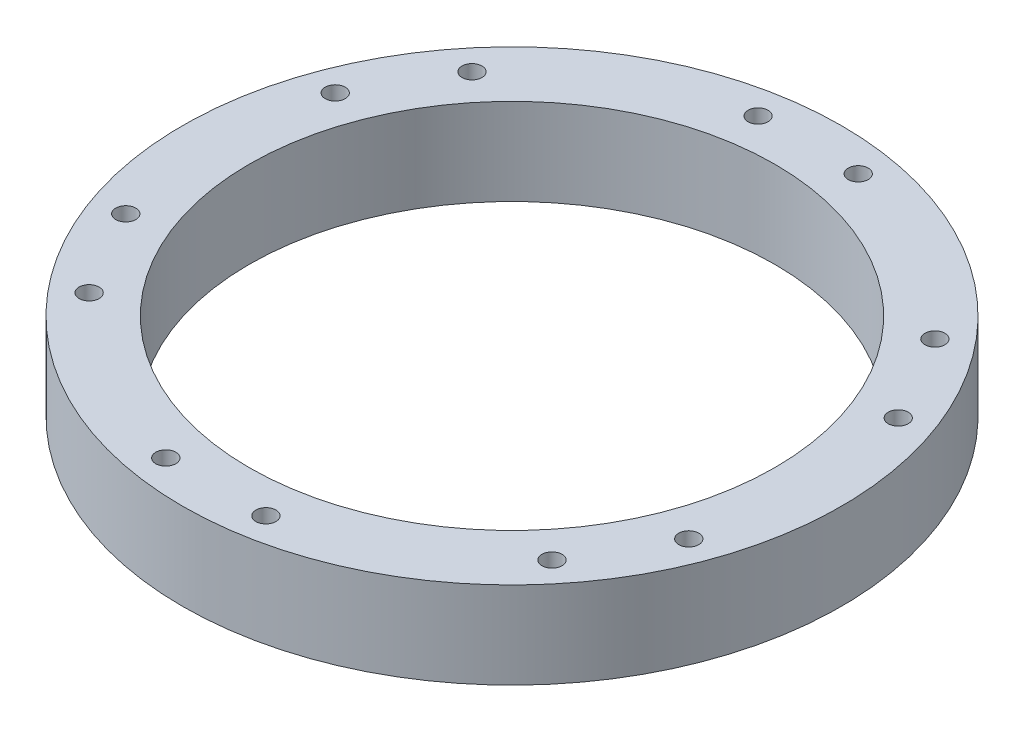
from build123d import *

# Parameters (mm, degrees)
SKETCH1_R           = 49.375
SKETCH1_R_2         = 39.375
BOSS_EXTRUDE1_DEPTH = 13
CUT_EXTRUDE1_REACH  = 73.027
SKETCH2_R           = 1.5
CIRPATTERN1_COUNT   = 6


with BuildPart() as part:
    # Sketch1 → Boss-Extrude1 (new body)
    with BuildSketch(Plane(origin=(0, 0, 0), x_dir=(1, 0, 0), z_dir=(0, 1, 0))):
        with Locations(Location((0, 0, 0), (0, 0, 90))):
            Circle(SKETCH1_R)
        with Locations(Location((0, 0, 0), (0, 0, 90))):
            Circle(SKETCH1_R_2, mode=Mode.SUBTRACT)
    extrude(amount=BOSS_EXTRUDE1_DEPTH)

    # Sketch2 → Cut-Extrude1 (cut, up to next)
    with BuildSketch(Plane(origin=(0, 13, 0), x_dir=(1, 0, 0), z_dir=(0, 1, 0)), mode=Mode.PRIVATE) as cut_extrude1_sk1:
        with Locations(Location((-7.5, -44.370598373, 0), (0, 0, 270))):
            Circle(SKETCH2_R)
    cut_extrude1_tool1 = extrude(cut_extrude1_sk1.sketch, amount=-CUT_EXTRUDE1_REACH, mode=Mode.PRIVATE) & part.part
    # Sketch2 → Cut-Extrude1 (cut, up to next)
    with BuildSketch(Plane(origin=(0, 13, 0), x_dir=(1, 0, 0), z_dir=(0, 1, 0)), mode=Mode.PRIVATE) as cut_extrude1_sk2:
        with Locations(Location((7.5, -44.370598373, 0), (0, 0, 270))):
            Circle(SKETCH2_R)
    cut_extrude1_tool2 = extrude(cut_extrude1_sk2.sketch, amount=-CUT_EXTRUDE1_REACH, mode=Mode.PRIVATE) & part.part
    cut_extrude1_1 = cut_extrude1_tool1.solids().sort_by_distance((-7.5, 13, 44.370598))[0]
    add(cut_extrude1_1, mode=Mode.SUBTRACT)
    cut_extrude1_2 = cut_extrude1_tool2.solids().sort_by_distance((7.5, 13, 44.370598))[0]
    add(cut_extrude1_2, mode=Mode.SUBTRACT)
    cut_extrude1 = cut_extrude1_1 + cut_extrude1_2  # Cut-Extrude1 as one shape, for the pattern or mirror that repeats it

    # CirPattern1: Cut-Extrude1 ×6 about axis
    cirpattern1_axis = Axis((0, 0, 0), (0, 1, 0))
    for i in range(1, CIRPATTERN1_COUNT):
        add(cut_extrude1.rotate(cirpattern1_axis, i * 360 / CIRPATTERN1_COUNT), mode=Mode.SUBTRACT)


solid = part.part
